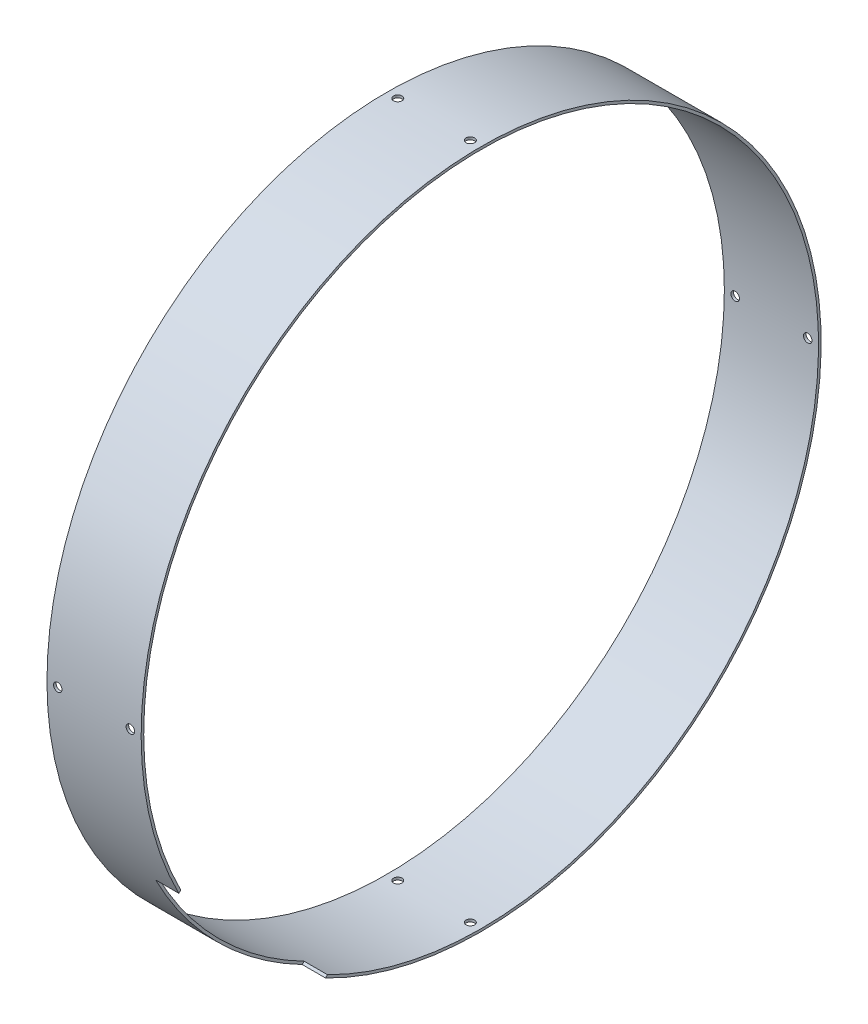
from build123d import *

# Parameters (mm, degrees)
SKETCH1_R             = 100
SKETCH1_R_2           = 99.238
BOSS_EXTRUDE1_DEPTH   = 27.7
F_2_5MM_DOWEL_HOLE1_D = 2.5
F_2_5MM_DOWEL_HOLE2_D = 2.5
SKETCH6_W             = 7.35
SKETCH6_H             = 61
CUT_EXTRUDE1_DEPTH    = 145.108605038


with BuildPart() as part:
    # Sketch1 → Boss-Extrude1 (new body)
    with BuildSketch(Plane(origin=(0, 0, 0), x_dir=(0, 0, -1), z_dir=(1, 0, 0))):
        Circle(SKETCH1_R)
        Circle(SKETCH1_R_2, mode=Mode.SUBTRACT)
    extrude(amount=BOSS_EXTRUDE1_DEPTH)

    # Ø2.5mm Dowel Hole1 (through all)
    with Locations(Plane.XY.offset(100)):
        with Locations((24.525, 0), (3.175, 0)):
            Hole(F_2_5MM_DOWEL_HOLE1_D / 2)

    # Ø2.5mm Dowel Hole2 (through all)
    with Locations(Plane(origin=(0, 100, 0), x_dir=(1, 0, 0), z_dir=(0, 1, 0))):
        with Locations((24.525, 0), (3.175, 0)):
            Hole(F_2_5MM_DOWEL_HOLE2_D / 2)

    # Sketch6 → Cut-Extrude1 (cut, through all)
    with BuildSketch(Plane(origin=(0, 0, 0), x_dir=(-1, 0, 0), z_dir=(0, 0.7071067811865475, -0.7071067811865477))):
        with Locations((-24.525, 0)):
            Rectangle(SKETCH6_W, SKETCH6_H)
    extrude(amount=-CUT_EXTRUDE1_DEPTH, mode=Mode.SUBTRACT)


solid = part.part
